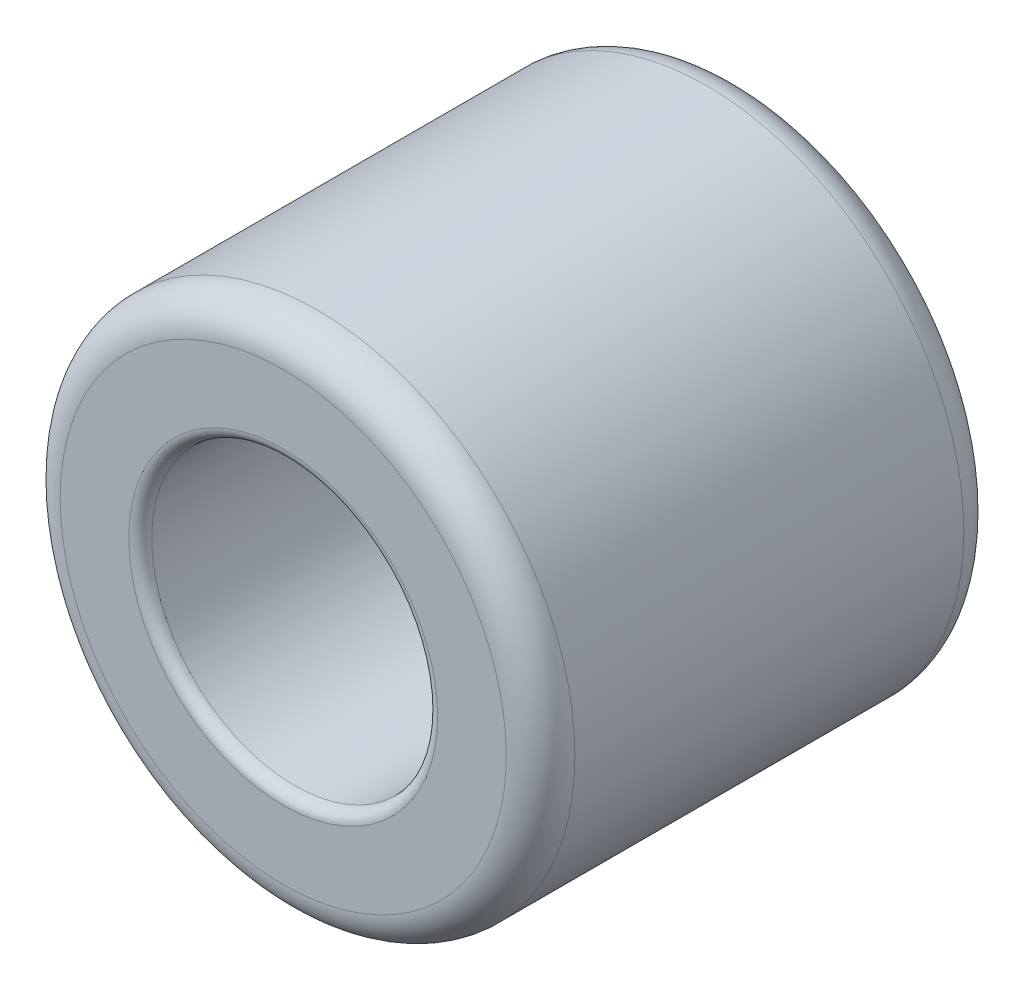
from build123d import *

# Parameters (mm, degrees)
SKETCH1_R           = 22.5
SKETCH1_R_2         = 12.5
BOSS_EXTRUDE1_DEPTH = 20
FILLET1_R           = 3
FILLET2_R           = 1


with BuildPart() as part:
    # Sketch1 → Boss-Extrude1 (new, symmetric)
    with BuildSketch(Plane.XY):
        Circle(SKETCH1_R)
        Circle(SKETCH1_R_2, mode=Mode.SUBTRACT)
    extrude(amount=BOSS_EXTRUDE1_DEPTH, both=True)

    # Fillet1
    fillet1_edges = [part.edges().sort_by_distance(p)[0] for p in [
        (-22.5, 0, 20),
        (-22.5, 0, -20),
    ]]
    fillet(fillet1_edges, radius=FILLET1_R)

    # Fillet2
    fillet2_edges = [part.edges().sort_by_distance(p)[0] for p in [
        (-12.5, 0, -20),
        (-12.5, 0, 20),
    ]]
    fillet(fillet2_edges, radius=FILLET2_R)


solid = part.part
